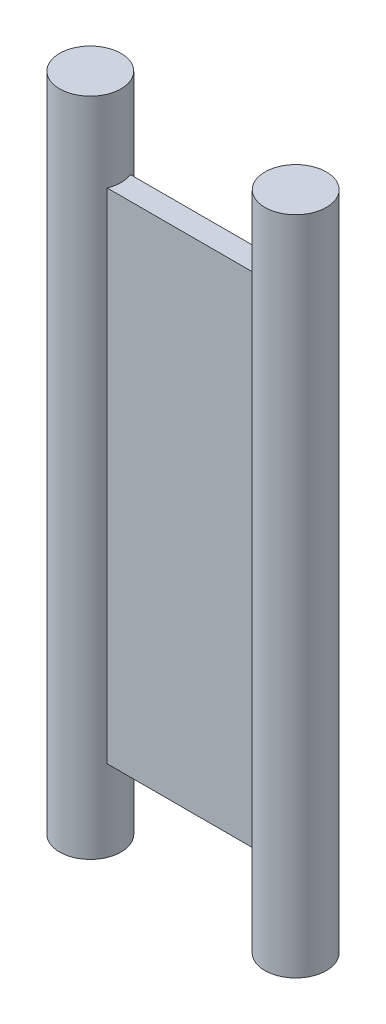
from build123d import *

# Parameters (mm, degrees)
SKETCH1_W           = 8.854
SKETCH1_H           = 1
BOSS_EXTRUDE1_DEPTH = 21.5
SKETCH2_R           = 1.325
BOSS_EXTRUDE2_DEPTH = 14.25


with BuildPart() as part:
    # Sketch1 → Boss-Extrude1 (new body)
    with BuildSketch(Plane(origin=(0, 0, 0), x_dir=(1, 0, 0), z_dir=(0, 1, 0))):
        Rectangle(SKETCH1_W, SKETCH1_H)
    extrude(amount=BOSS_EXTRUDE1_DEPTH)

    # Sketch2 → Boss-Extrude2 (add, symmetric)
    with BuildSketch(Plane(origin=(0, 10.75, 0), x_dir=(1, 0, 0), z_dir=(0, 1, 0))):
        with Locations(Location((-4.427, 0, 0), (0, 0, 270))):
            Circle(SKETCH2_R)
        with Locations(Location((4.427, 0, 0), (0, 0, 270))):
            Circle(SKETCH2_R)
    extrude(amount=BOSS_EXTRUDE2_DEPTH, both=True)


solid = part.part
